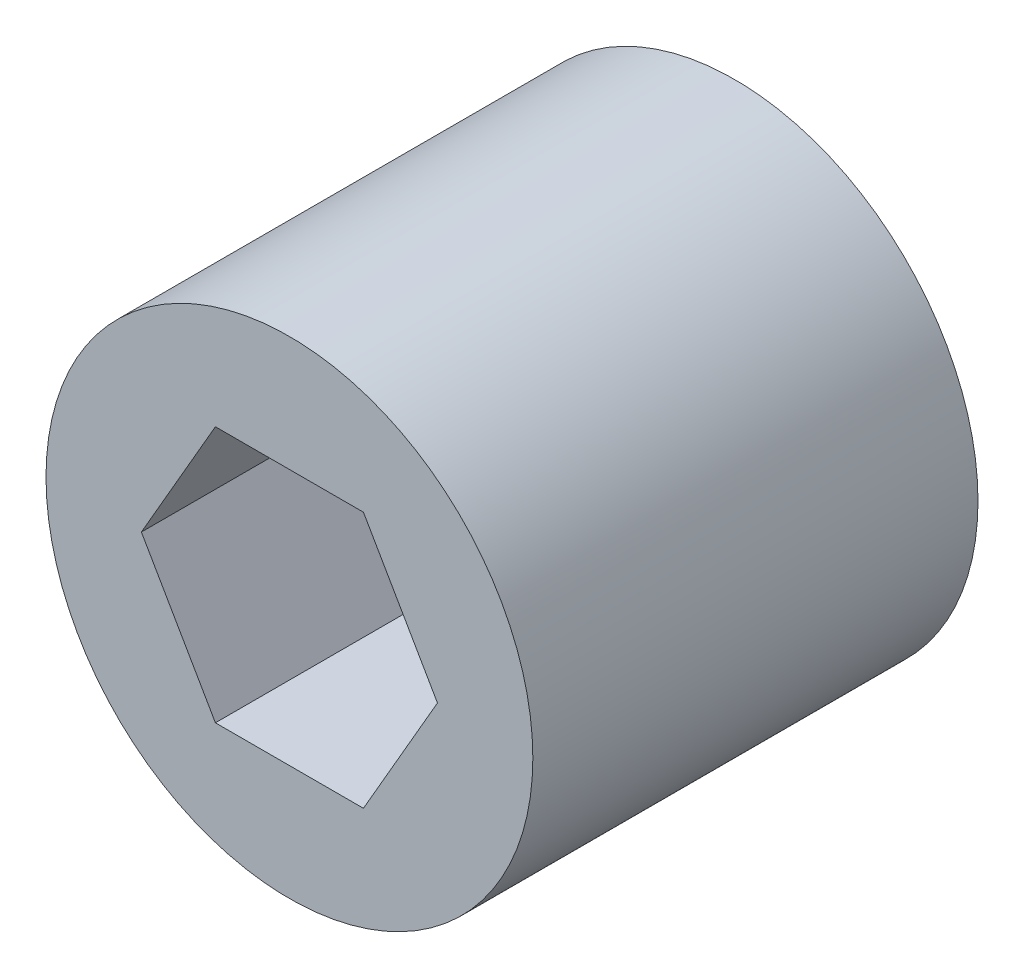
from build123d import *

# Parameters (mm, degrees)
SKETCH1_R           = 9.525
BOSS_EXTRUDE1_DEPTH = 8.709249917


with BuildPart() as part:
    # Sketch1 → Boss-Extrude1 (new, symmetric)
    with BuildSketch(Plane.XY):
        Circle(SKETCH1_R)
        Polygon((-5.792555251, 0), (-2.896277625, -5.0165), (2.896277625, -5.0165), (5.792555251, 0), (2.896277625, 5.0165), (-2.896277625, 5.0165), align=None, mode=Mode.SUBTRACT)
    extrude(amount=BOSS_EXTRUDE1_DEPTH, both=True)


solid = part.part
